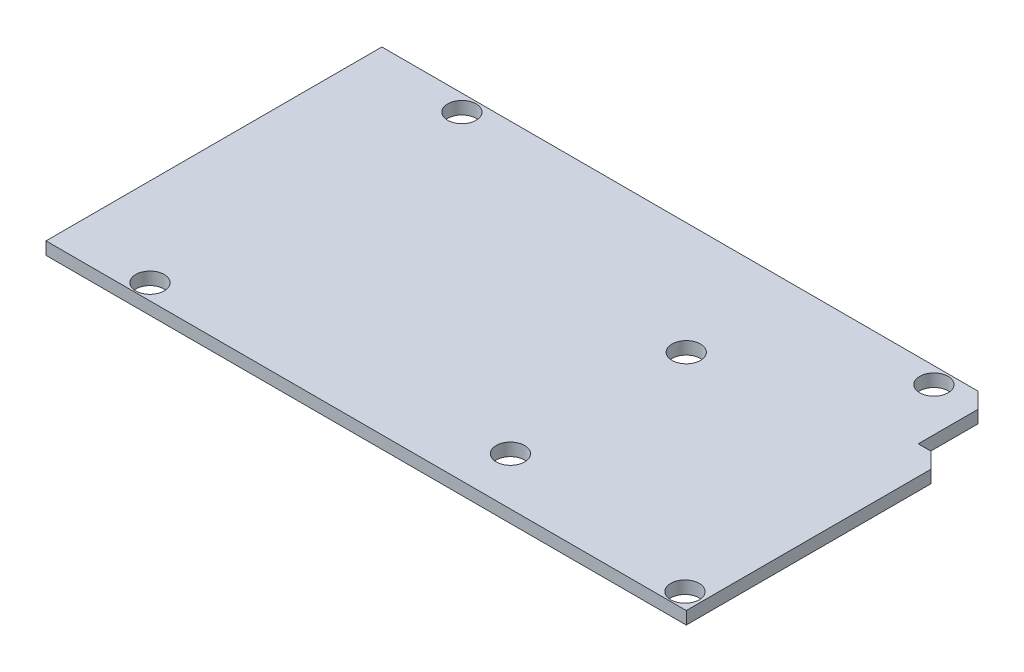
from build123d import *

# Parameters (mm, degrees)
BOSS_EXTRUDE1_DEPTH = 2
SKETCH2_R           = 2.261
CUT_EXTRUDE1_DEPTH  = 4
SKETCH2_3_R         = 2.261
CUT_EXTRUDE2_DEPTH  = 4


with BuildPart() as part:
    # Sketch1 → Boss-Extrude1 (new body)
    with BuildSketch(Plane(origin=(0, 0, 0), x_dir=(1, 0, 0), z_dir=(0, 1, 0))):
        Polygon((-35.69434129, 0), (-35.69434129, 53.3), (58.90182323, 53.3), (61.40182323, 50.8), (61.40182323, 41.31634957), (63.40565871, 41.31634957), (65.90565871, 38.81634957), (65.90565871, 0), align=None)
    extrude(amount=BOSS_EXTRUDE1_DEPTH)

    # Sketch2 → Cut-Extrude1 (cut)
    with BuildSketch(Plane(origin=(0, 2, 0), x_dir=(1, 0, 0), z_dir=(0, 1, 0))):
        with Locations((-20.39434129, 50.7)):
            Circle(SKETCH2_R)
    extrude(amount=-CUT_EXTRUDE1_DEPTH, mode=Mode.SUBTRACT)

    # Sketch2<3> → Cut-Extrude2 (cut)
    with BuildSketch(Plane(origin=(0, 2, 0), x_dir=(1, 0, 0), z_dir=(0, 1, 0))):
        with Locations((-21.69434129, 2.5)):
            Circle(SKETCH2_3_R)
        with Locations((63.201299911, 2.5)):
            Circle(SKETCH2_3_R)
        with Locations((30.40565871, 7.6)):
            Circle(SKETCH2_3_R)
        with Locations((30.40565871, 35.5)):
            Circle(SKETCH2_3_R)
        with Locations((54.50565871, 50.7)):
            Circle(SKETCH2_3_R)
    extrude(amount=-CUT_EXTRUDE2_DEPTH, mode=Mode.SUBTRACT)


solid = part.part
